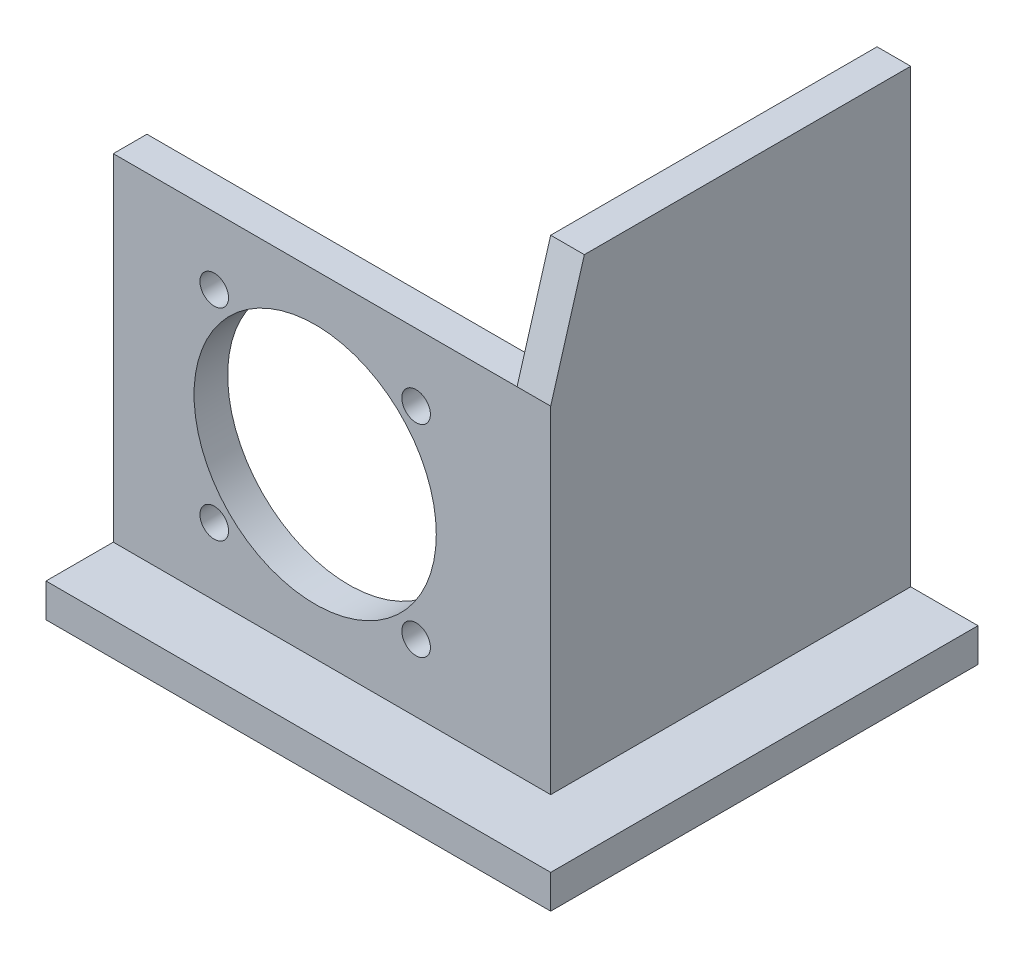
from build123d import *

# Parameters (mm, degrees)
SKETCH1_W           = 120
SKETCH1_H           = 110
SKETCH1_R           = 4.25
SKETCH1_R_2         = 36
BOSS_EXTRUDE1_DEPTH = 10
SKETCH2_W           = 107
SKETCH2_H           = 144
BOSS_EXTRUDE2_DEPTH = 10
CHAMFER1_SIZE       = 10
CHAMFER1_SIZE2      = 34
BOSS_EXTRUDE4_DEPTH = 10


with BuildPart() as part:
    # Sketch1 → Boss-Extrude1 (new body)
    with BuildSketch(Plane.XY):
        with Locations((-30, -35)):
            Rectangle(SKETCH1_W, SKETCH1_H)
        Circle(SKETCH1_R, mode=Mode.SUBTRACT)
        with Locations((0, -60)):
            Circle(SKETCH1_R, mode=Mode.SUBTRACT)
        with Locations((-30, -30)):
            Circle(SKETCH1_R_2, mode=Mode.SUBTRACT)
        with Locations(Location((-60, 0, 0), (0, 0, 180))):
            Circle(SKETCH1_R, mode=Mode.SUBTRACT)
        with Locations(Location((-60, -60, 0), (0, 0, 180))):
            Circle(SKETCH1_R, mode=Mode.SUBTRACT)
    extrude(amount=BOSS_EXTRUDE1_DEPTH)

    # Sketch2 → Boss-Extrude2 (add)
    with BuildSketch(Plane(origin=(30, 0, 0), x_dir=(0, 0, -1), z_dir=(1, 0, 0))):
        with Locations((43.5, -18)):
            Rectangle(SKETCH2_W, SKETCH2_H)
    extrude(amount=BOSS_EXTRUDE2_DEPTH)

    # Chamfer1
    chamfer1_edges = [part.edges().sort_by_distance(p)[0] for p in [
        (35, 54, 10),
    ]]
    chamfer1_side = [part.faces().sort_by_distance(p)[0] for p in [
        (35, 54, -43.5),
    ]]
    chamfer(chamfer1_edges, length=CHAMFER1_SIZE, length2=CHAMFER1_SIZE2, reference=chamfer1_side[0])

    # Sketch6 → Boss-Extrude4 (add)
    with BuildSketch(Plane.XZ.offset(90)):
        Polygon((-90, 30), (-90, 10), (40, 10), (40, -97), (60, -97), (60, 30), align=None)
    extrude(amount=-BOSS_EXTRUDE4_DEPTH)


solid = part.part
